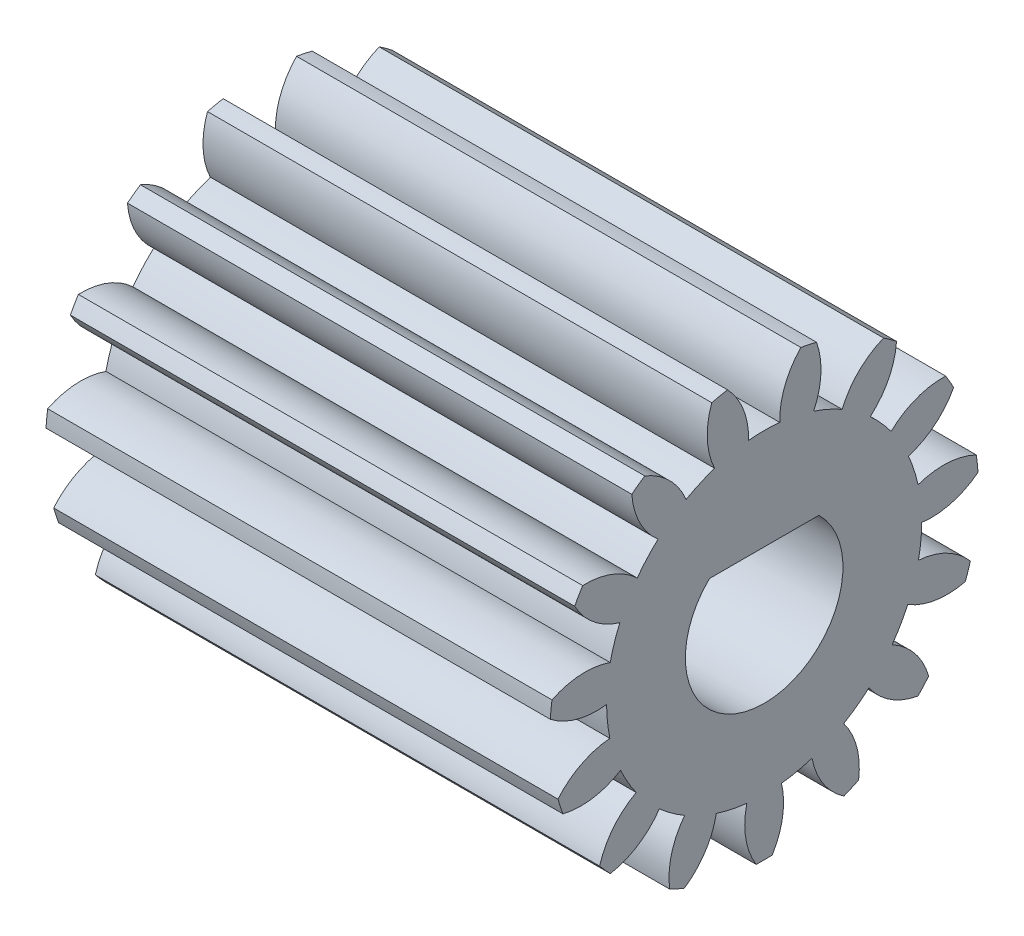
from build123d import *

# Parameters (mm, degrees)
BASPROSKE_W         = 16
BASPROSKE_H         = 6.8
TOOTHCUT_DEPTH      = 19.667619023
TEETHCUTS_COUNT     = 15
TEETHCUTS_ANGLE     = 336
BORSKE_R            = 2
BORE_DEPTH          = 50.000508
BOSS_EXTRUDE1_DEPTH = 16
CUT_EXTRUDE1_DEPTH  = 19.662017839


with BuildPart() as part:
    # BasProSke → Base-Revolve (revolve)
    with BuildSketch(Plane(origin=(0, 0, 0), x_dir=(1, 0, 0), z_dir=(0, 1, 0)), mode=Mode.PRIVATE) as base_revolve_sk:
        with Locations((8, 3.4)):
            Rectangle(BASPROSKE_W, BASPROSKE_H)
    revolve(base_revolve_sk.sketch.rotate(Axis((-10, 0, 0), (1, 0, 0)), 180), axis=Axis((-10, 0, 0), (1, 0, 0)))

    # TooCutSke → ToothCut (cut, through all)
    with BuildSketch(Plane(origin=(0, 0, 0), x_dir=(0, 0, -1), z_dir=(1, 0, 0))):
        with BuildLine():
            ThreePointArc((0.495059869, 4.974426271), (0, 4.999), (-0.495059869, 4.974426271))
            ThreePointArc((-0.495059869, 4.974426271), (-0.662158854, 5.91840511), (-1.185392978, 6.72167603))
            ThreePointArc((-1.185392978, 6.72167603), (0, 6.8254), (1.185392978, 6.72167603))
            ThreePointArc((1.185392978, 6.72167603), (0.662158854, 5.91840511), (0.495059869, 4.974426271))
        make_face()
    toothcut = extrude(amount=TOOTHCUT_DEPTH, mode=Mode.SUBTRACT)

    # TeethCuts: ToothCut ×15 about axis
    teethcuts_axis = Axis((-10, 0, 0), (1, 0, 0))
    for i in range(1, TEETHCUTS_COUNT):
        add(toothcut.rotate(teethcuts_axis, i * TEETHCUTS_ANGLE / (TEETHCUTS_COUNT - 1)), mode=Mode.SUBTRACT)

    # BorSke → Bore (cut, symmetric)
    with BuildSketch(Plane(origin=(0, 0, 0), x_dir=(0, 0, -1), z_dir=(1, 0, 0))):
        with Locations(Location((0, 0, 0), (0, 0, 180))):
            Circle(BORSKE_R)
    extrude(amount=BORE_DEPTH, both=True, mode=Mode.SUBTRACT)

    # Sketch1 → Boss-Extrude1 (add, through all)
    with BuildSketch(Plane(origin=(16, 0, 0), x_dir=(0, 0, -1), z_dir=(1, 0, 0))):
        with BuildLine():
            Line((-0.871779789, 1.8), (0.871779789, 1.8))
            ThreePointArc((0.871779789, 1.8), (0, 2), (-0.871779789, 1.8))
        make_face()
    extrude(amount=-BOSS_EXTRUDE1_DEPTH)

    # Sketch1<3> → Cut-Extrude1 (cut, through all)
    with BuildSketch(Plane(origin=(16, 0, 0), x_dir=(0, 0, -1), z_dir=(1, 0, 0))):
        with BuildLine():
            ThreePointArc((2.5, 0), (2.300797459, 0.977921803), (1.734935157, 1.8))
            Line((1.734935157, 1.8), (-1.734935157, 1.8))
            ThreePointArc((-1.734935157, 1.8), (-0.977921803, -2.300797459), (2.5, 0))
        make_face()
    extrude(amount=-CUT_EXTRUDE1_DEPTH, mode=Mode.SUBTRACT)


solid = part.part
